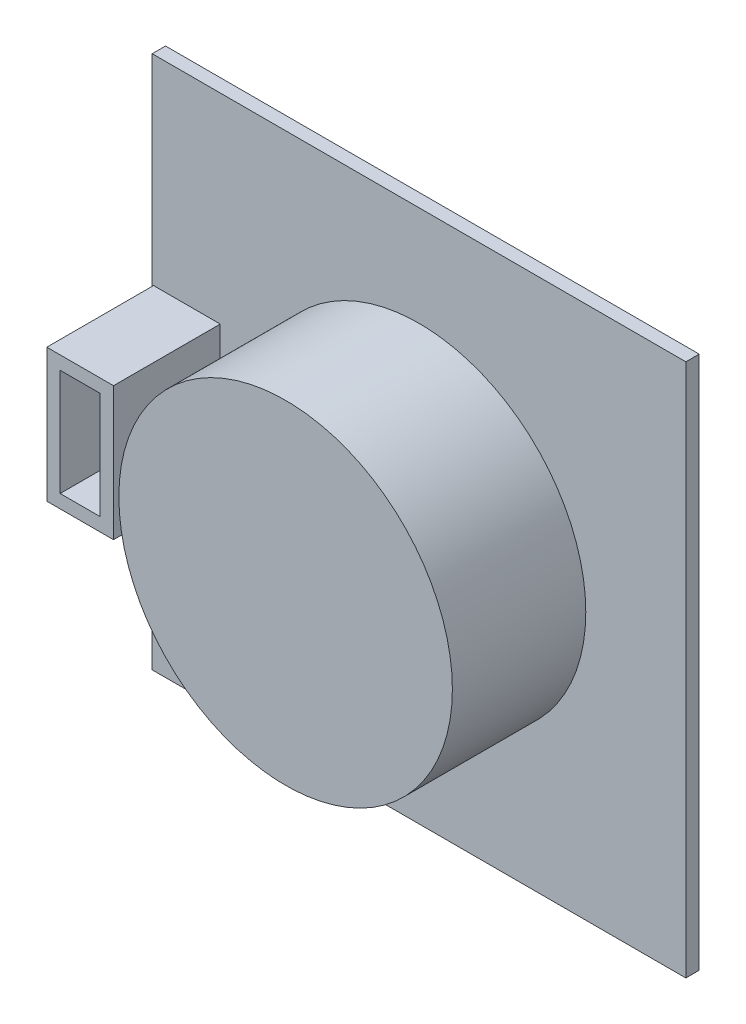
from build123d import *

# Parameters (mm, degrees)
ESQUISSE1_W             = 4
ESQUISSE1_H             = 4
BOSS_EXTRU_1_DEPTH      = 0.1
ESQUISSE2_R             = 1.25
BOSS_EXTRU_2_DEPTH      = 1
ESQUISSE4_W             = 0.5
ESQUISSE4_H             = 1
BOSS_EXTRU_3_DEPTH      = 0.8
ESQUISSE5_W             = 0.299566549
ESQUISSE5_H             = 0.8
ENL_V_MAT_EXTRU_1_DEPTH = 0.7


with BuildPart() as part:
    # Esquisse1 → Boss.-Extru.1 (new body)
    with BuildSketch(Plane.XY):
        with Locations((2, 2)):
            Rectangle(ESQUISSE1_W, ESQUISSE1_H)
    extrude(amount=BOSS_EXTRU_1_DEPTH)

    # Esquisse2 → Boss.-Extru.2 (add)
    with BuildSketch(Plane.XY.offset(0.1)):
        with Locations((2, 2)):
            Circle(ESQUISSE2_R)
    extrude(amount=BOSS_EXTRU_2_DEPTH)

    # Esquisse4 → Boss.-Extru.3 (add)
    with BuildSketch(Plane.XY.offset(0.1)):
        with Locations((0.26, 2)):
            Rectangle(ESQUISSE4_W, ESQUISSE4_H)
    extrude(amount=BOSS_EXTRU_3_DEPTH)

    # Esquisse5 → Enlèv. mat.-Extru.1 (cut)
    with BuildSketch(Plane.XY.offset(0.9)):
        with Locations((0.259783274, 2)):
            Rectangle(ESQUISSE5_W, ESQUISSE5_H)
    extrude(amount=-ENL_V_MAT_EXTRU_1_DEPTH, mode=Mode.SUBTRACT)


solid = part.part
